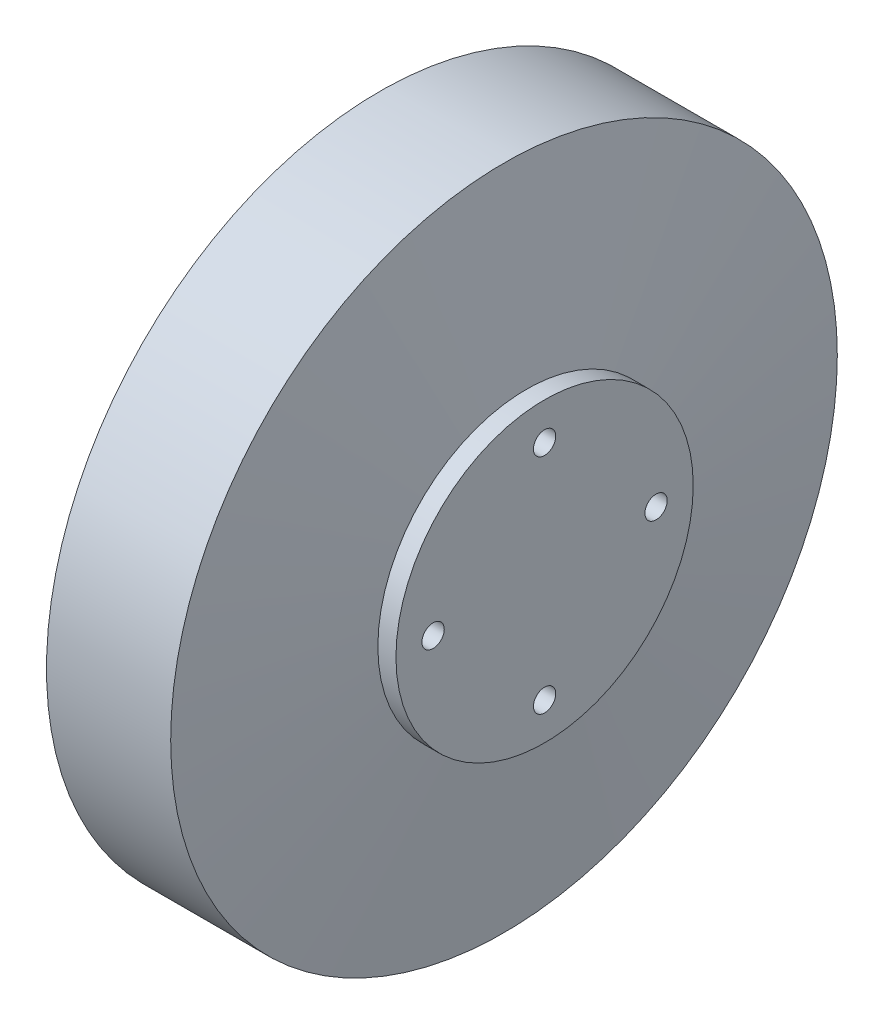
from build123d import *

# Parameters (mm, degrees)
BOSS_EXTRUDE3_REACH      = 69.191
SKETCH2_6_R              = 20
SKETCH2_6_R_2            = 1.5
CUT_EXTRUDE1_DEPTH       = 68.190940094
CUT_EXTRUDE1_DEPTH_BACK  = 68.190940094
SKETCH2_R                = 1.5
SKETCH3_W                = 10
SKETCH3_H                = 5
BOSS_EXTRUDE1_DEPTH      = 1
CIRPATTERN1_COUNT        = 42
M2_CLEARANCE_HOLE1_D     = 2.4
M2_CLEARANCE_HOLE1_DEPTH = 5
M2_CLEARANCE_HOLE1_TIP   = 0.721032743


with BuildPart() as part:
    # Sketch1 → Revolve1 (revolve)
    with BuildSketch(Plane.XY):
        Polygon((-5.461187215, 44.85), (-22.171545518, 44.85), (-22.171545518, 42.35), (-7.171545518, 42.35), (-3.171545518, 9.5), (-7.171545518, 7.5), (-11.171545518, 7.5), (-11.171545518, 0), (0, 0), align=None)
    revolve(axis=Axis((0, 0, 0), (-1, 0, 0)))

    # Sketch2<6> → Boss-Extrude3 (add, up to next)
    with BuildSketch(Plane(origin=(0, 0, 0), x_dir=(0, 0, -1), z_dir=(1, 0, 0)), mode=Mode.PRIVATE) as boss_extrude3_sk1:
        Circle(SKETCH2_6_R)
        with Locations((0, 15)):
            Circle(SKETCH2_6_R_2, mode=Mode.SUBTRACT)
        with Locations((0, -15)):
            Circle(SKETCH2_6_R_2, mode=Mode.SUBTRACT)
        with Locations((15, 0)):
            Circle(SKETCH2_6_R_2, mode=Mode.SUBTRACT)
        with Locations((-15, 0)):
            Circle(SKETCH2_6_R_2, mode=Mode.SUBTRACT)
    boss_extrude3_tool1 = extrude(boss_extrude3_sk1.sketch, amount=-BOSS_EXTRUDE3_REACH, mode=Mode.PRIVATE) - part.part
    add(boss_extrude3_tool1.solids().sort_by_distance((0, 0, 0))[0])

    # Sketch2 → Cut-Extrude1 (cut, two sides: drawn at the far end of the back side and taken through both)
    with BuildSketch(Plane(origin=(0, 0, 0), x_dir=(0, 0, -1), z_dir=(1, 0, 0)).offset(-CUT_EXTRUDE1_DEPTH_BACK)):
        with Locations((0, 15)):
            Circle(SKETCH2_R)
        with Locations((0, -15)):
            Circle(SKETCH2_R)
        with Locations((15, 0)):
            Circle(SKETCH2_R)
        with Locations((-15, 0)):
            Circle(SKETCH2_R)
    extrude(amount=CUT_EXTRUDE1_DEPTH + CUT_EXTRUDE1_DEPTH_BACK, mode=Mode.SUBTRACT)

    # Sketch3 → Boss-Extrude1 (add)
    with BuildSketch(Plane(origin=(0, 0, 42.35), x_dir=(-1, 0, 0), z_dir=(0, 0, -1))):
        with Locations((15.585772759, 0)):
            Rectangle(SKETCH3_W, SKETCH3_H)
    boss_extrude1 = extrude(amount=BOSS_EXTRUDE1_DEPTH)

    # CirPattern1: Boss-Extrude1 ×42 about axis
    cirpattern1_axis = Axis((-11.171545518, 0, 0), (1, 0, 0))
    for i in range(1, CIRPATTERN1_COUNT):
        add(boss_extrude1.rotate(cirpattern1_axis, i * 360 / CIRPATTERN1_COUNT))

    # M2 Clearance Hole1
    with Locations(Plane.ZY.offset(11.171545518)):
        with Locations((0, 0)):
            Hole(M2_CLEARANCE_HOLE1_D / 2, depth=M2_CLEARANCE_HOLE1_DEPTH)
            with Locations((0, 0, -(M2_CLEARANCE_HOLE1_DEPTH + M2_CLEARANCE_HOLE1_TIP / 2))):  # 118° drill point
                Cone(0, M2_CLEARANCE_HOLE1_D / 2, M2_CLEARANCE_HOLE1_TIP, mode=Mode.SUBTRACT)


solid = part.part
